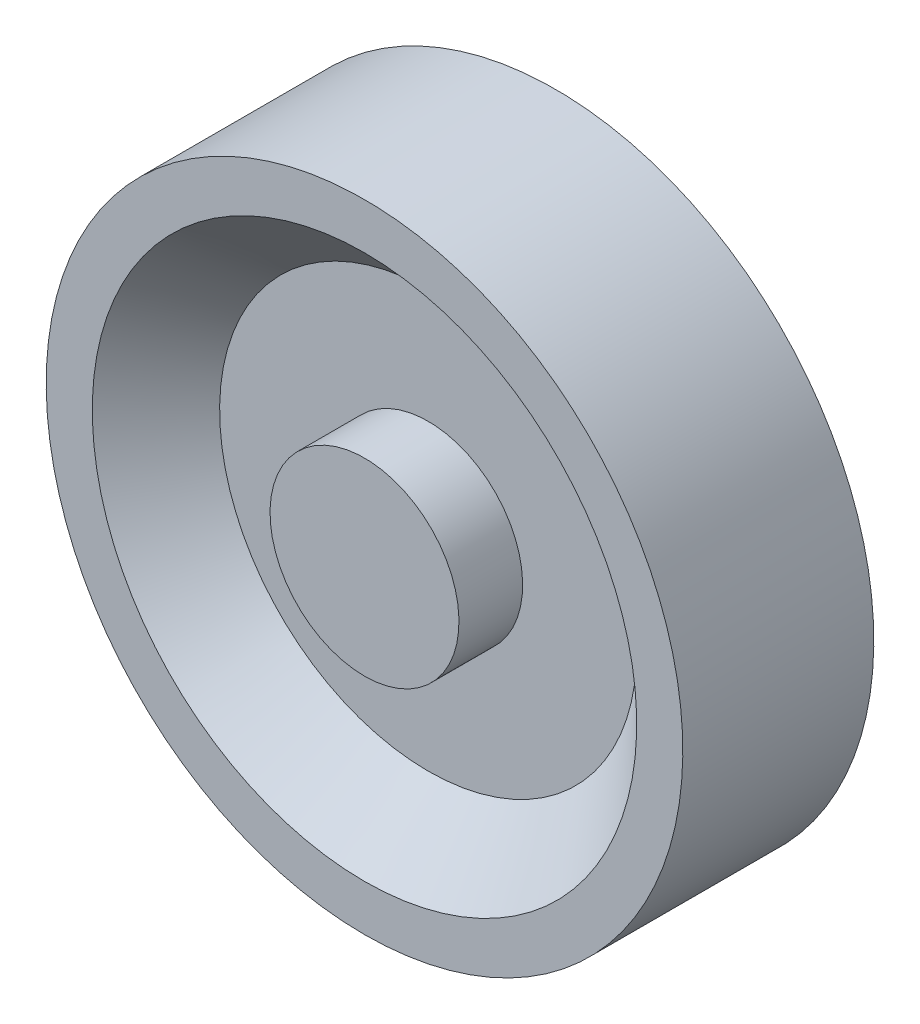
from build123d import *


with BuildPart() as part:
    # Sketch2 → Revolve1 (revolve)
    with BuildSketch(Plane(origin=(0, 0, 0), x_dir=(0, 0, -1), z_dir=(1, 0, 0)), mode=Mode.PRIVATE) as revolve1_sk:
        Polygon((0, 0), (3, 0), (3, 3), (15, 3), (15, 7.42), (10, 7.42), (10, 16.38), (15, 21.38), (15, 25), (0, 25), (0, 21.38), (5, 16.38), (5, 7.42), (0, 7.42), align=None)
    revolve(revolve1_sk.sketch.rotate(Axis((0, 0, 0), (0, 0, -1)), 180), axis=Axis((0, 0, 0), (0, 0, -1)))


solid = part.part
